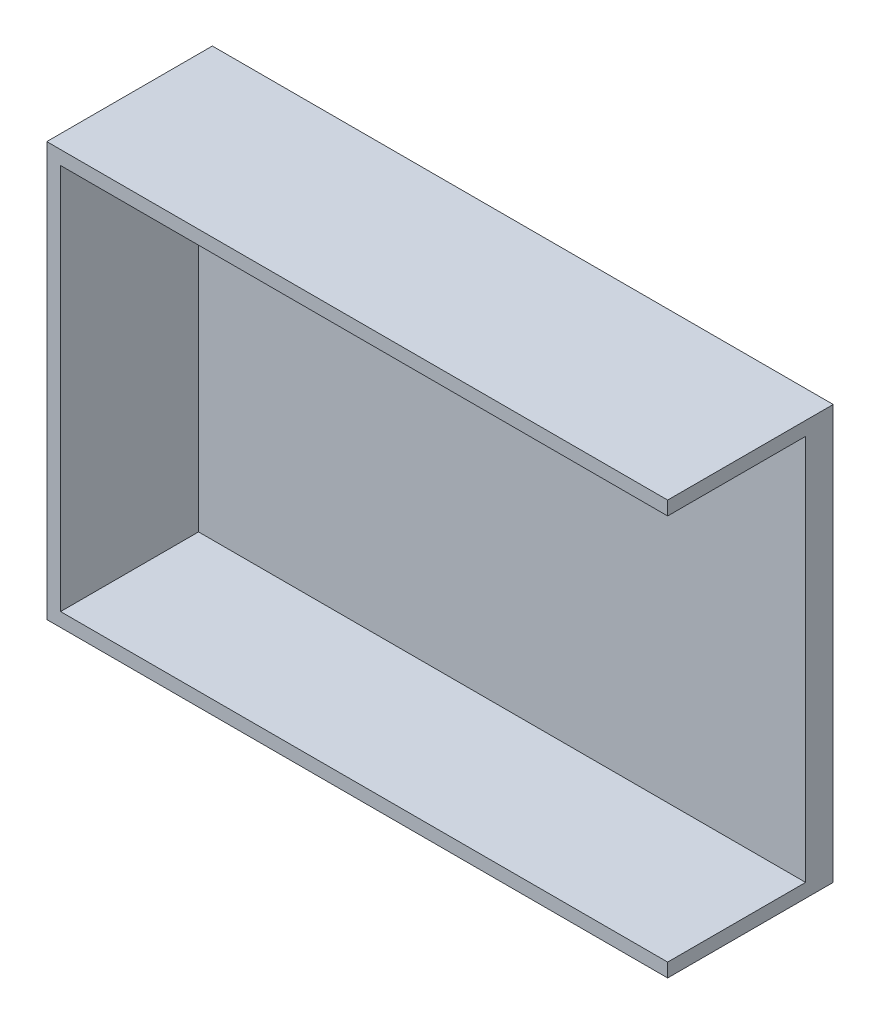
from build123d import *

# Parameters (mm, degrees)
SKETCH1_W           = 45
SKETCH1_H           = 30
BOSS_EXTRUDE1_DEPTH = 12
SKETCH2_W           = 44
SKETCH2_H           = 28
CUT_EXTRUDE1_DEPTH  = 10


with BuildPart() as part:
    # Sketch1 → Boss-Extrude1 (new body)
    with BuildSketch(Plane.XY):
        with Locations((22.5, 15)):
            Rectangle(SKETCH1_W, SKETCH1_H)
    extrude(amount=BOSS_EXTRUDE1_DEPTH)

    # Sketch2 → Cut-Extrude1 (cut)
    with BuildSketch(Plane.XY.offset(12)):
        with Locations((23, 15)):
            Rectangle(SKETCH2_W, SKETCH2_H)
    extrude(amount=-CUT_EXTRUDE1_DEPTH, mode=Mode.SUBTRACT)


solid = part.part
